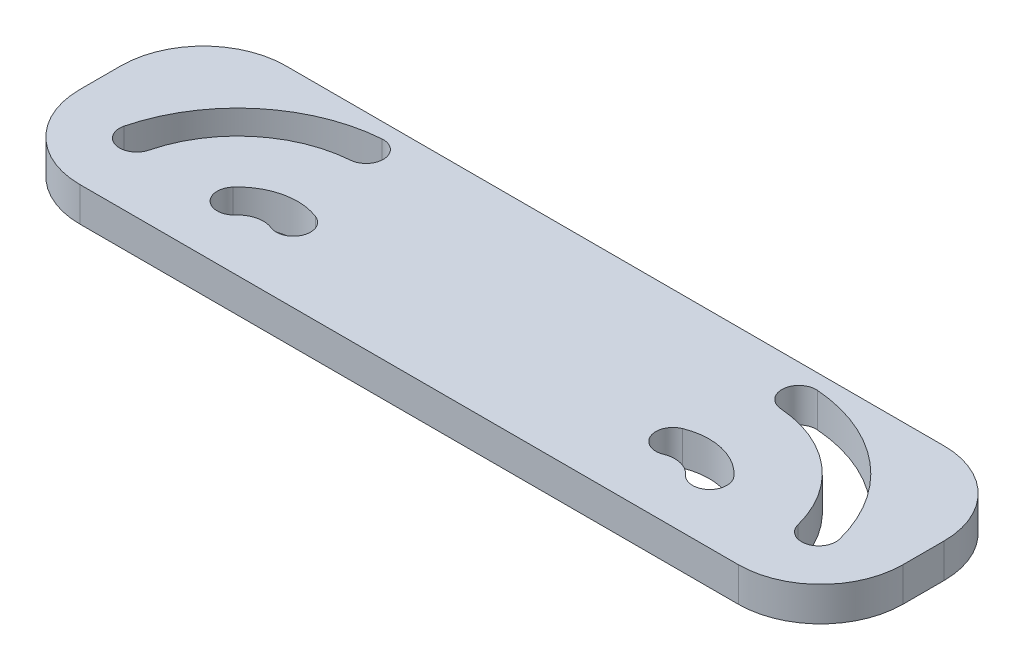
from build123d import *

# Parameters (mm, degrees)
SKETCH1_W           = 76.2
SKETCH1_H           = 19.05
BOSS_EXTRUDE1_DEPTH = 3.175
CUT_EXTRUDE1_DEPTH  = 40.400713826
FILLET1_R           = 7.62


with BuildPart() as part:
    # Sketch1 → Boss-Extrude1 (new body)
    with BuildSketch(Plane(origin=(0, 0, 0), x_dir=(1, 0, 0), z_dir=(0, 1, 0))):
        Rectangle(SKETCH1_W, SKETCH1_H)
    extrude(amount=BOSS_EXTRUDE1_DEPTH)

    # Sketch6 → Cut-Extrude1 (cut, through all)
    with BuildSketch(Plane(origin=(0, 3.175, 0), x_dir=(1, 0, 0), z_dir=(0, 1, 0))):
        with BuildLine():
            ThreePointArc((-20.158139463, 8.116433777), (-28.391214829, 4.751683872), (-33.113993118, -2.784922601))
            ThreePointArc((-33.113993118, -2.784922601), (-31.965241133, -4.713829384), (-30.03633435, -3.565077399))
            ThreePointArc((-30.03633435, -3.565077399), (-26.347053439, 2.322274641), (-19.915642535, 4.950707914))
            ThreePointArc((-19.915642535, 4.950707914), (-18.454028067, 6.654819309), (-20.158139463, 8.116433777))
        make_face()
        with BuildLine():
            ThreePointArc((-16.980295432, -1.193621711), (-20.312174356, -0.939008413), (-23.187529976, -2.641528649))
            ThreePointArc((-23.187529976, -2.641528649), (-23.064941797, -4.883243314), (-20.823227132, -4.760655135))
            ThreePointArc((-20.823227132, -4.760655135), (-19.590931867, -4.031003605), (-18.162983757, -4.14012359))
            ThreePointArc((-18.162983757, -4.14012359), (-16.098388655, -3.258216813), (-16.980295432, -1.193621711))
        make_face()
        with BuildLine():
            ThreePointArc((16.980295432, -1.193621711), (20.312174356, -0.939008413), (23.187529976, -2.641528649))
            ThreePointArc((23.187529976, -2.641528649), (23.064941797, -4.883243314), (20.823227132, -4.760655135))
            ThreePointArc((20.823227132, -4.760655135), (19.590931867, -4.031003605), (18.162983757, -4.14012359))
            ThreePointArc((18.162983757, -4.14012359), (16.098388655, -3.258216813), (16.980295432, -1.193621711))
        make_face()
        with BuildLine():
            ThreePointArc((20.158139463, 8.116433777), (28.391214829, 4.751683872), (33.113993118, -2.784922601))
            ThreePointArc((33.113993118, -2.784922601), (31.965241133, -4.713829384), (30.03633435, -3.565077399))
            ThreePointArc((30.03633435, -3.565077399), (26.347053439, 2.322274641), (19.915642535, 4.950707914))
            ThreePointArc((19.915642535, 4.950707914), (18.454028067, 6.654819309), (20.158139463, 8.116433777))
        make_face()
    extrude(amount=-CUT_EXTRUDE1_DEPTH, mode=Mode.SUBTRACT)

    # Fillet1
    fillet1_edges = [part.edges().sort_by_distance(p)[0] for p in [
        (38.1, 1.5875, 9.525),
        (-38.1, 1.5875, 9.525),
        (-38.1, 1.5875, -9.525),
        (38.1, 1.5875, -9.525),
    ]]
    fillet(fillet1_edges, radius=FILLET1_R)


solid = part.part
